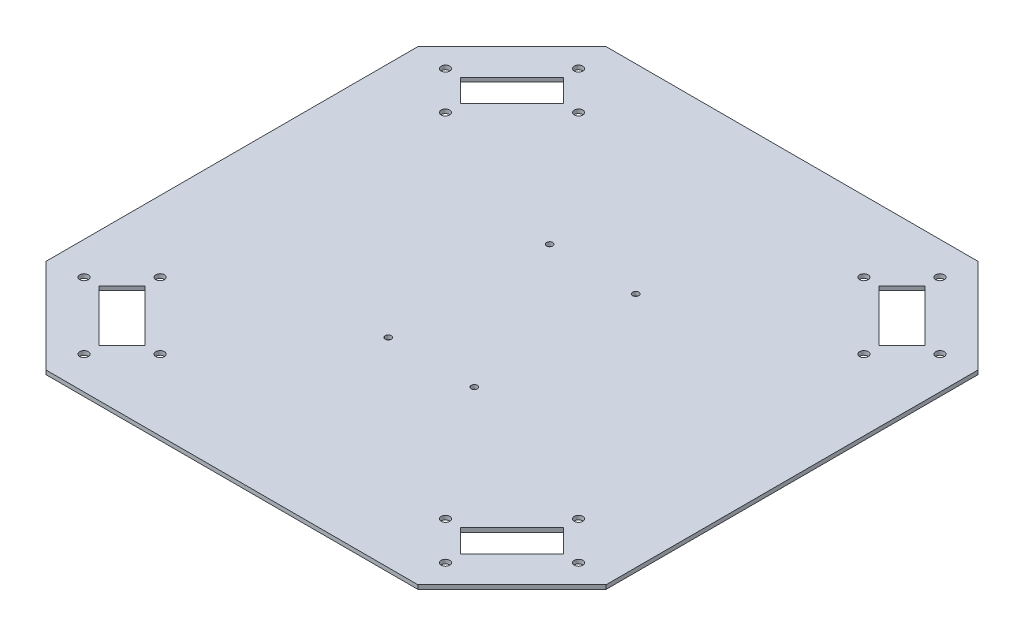
from build123d import *

# Parameters (mm, degrees)
SKETCH2_R           = 1.6
SKETCH2_R_2         = 1.15
BOSS_EXTRUDE1_DEPTH = 1.5


with BuildPart() as part:
    # Sketch2 → Boss-Extrude1 (new body)
    with BuildSketch(Plane(origin=(0, 0, 0), x_dir=(1, 0, 0), z_dir=(0, 1, 0))):
        Polygon((104.138617256, -69.138617256), (104.138617256, 69.138617256), (69.138617256, 104.138617256), (-69.138617256, 104.138617256), (-104.138617256, 69.138617256), (-104.138617256, -69.138617256), (-69.138617256, -104.138617256), (69.138617256, -104.138617256), align=None)
        with Locations(Location((67.193180773, -91.941918115, 0), (0, 0, 270))):
            Circle(SKETCH2_R, mode=Mode.SUBTRACT)
        with Locations(Location((53.051045149, -77.799782491, 0), (0, 0, 270))):
            Circle(SKETCH2_R, mode=Mode.SUBTRACT)
        with Locations(Location((77.799782491, -53.051045149, 0), (0, 0, 270))):
            Circle(SKETCH2_R, mode=Mode.SUBTRACT)
        with Locations(Location((91.941918115, -67.193180773, 0), (0, 0, 270))):
            Circle(SKETCH2_R, mode=Mode.SUBTRACT)
        with Locations(Location((-67.193180773, -91.941918115, 0), (0, 0, 270))):
            Circle(SKETCH2_R, mode=Mode.SUBTRACT)
        with Locations(Location((-91.941918115, -67.193180773, 0), (0, 0, 270))):
            Circle(SKETCH2_R, mode=Mode.SUBTRACT)
        with Locations(Location((-77.799782491, -53.051045149, 0), (0, 0, 270))):
            Circle(SKETCH2_R, mode=Mode.SUBTRACT)
        with Locations(Location((-53.051045149, -77.799782491, 0), (0, 0, 270))):
            Circle(SKETCH2_R, mode=Mode.SUBTRACT)
        with Locations(Location((-77.799782491, 53.051045149, 0), (0, 0, 270))):
            Circle(SKETCH2_R, mode=Mode.SUBTRACT)
        with Locations(Location((-53.051045149, 77.799782491, 0), (0, 0, 270))):
            Circle(SKETCH2_R, mode=Mode.SUBTRACT)
        with Locations(Location((-67.193180773, 91.941918115, 0), (0, 0, 270))):
            Circle(SKETCH2_R, mode=Mode.SUBTRACT)
        with Locations(Location((-91.941918115, 67.193180773, 0), (0, 0, 270))):
            Circle(SKETCH2_R, mode=Mode.SUBTRACT)
        with Locations(Location((77.799782491, 53.051045149, 0), (0, 0, 270))):
            Circle(SKETCH2_R, mode=Mode.SUBTRACT)
        with Locations(Location((53.051045149, 77.799782491, 0), (0, 0, 270))):
            Circle(SKETCH2_R, mode=Mode.SUBTRACT)
        with Locations(Location((67.193180773, 91.941918115, 0), (0, 0, 270))):
            Circle(SKETCH2_R, mode=Mode.SUBTRACT)
        with Locations(Location((91.941918115, 67.193180773, 0), (0, 0, 270))):
            Circle(SKETCH2_R, mode=Mode.SUBTRACT)
        with Locations(Location((16, 30, 0), (0, 0, 270))):
            Circle(SKETCH2_R_2, mode=Mode.SUBTRACT)
        with Locations(Location((-16, 30, 0), (0, 0, 270))):
            Circle(SKETCH2_R_2, mode=Mode.SUBTRACT)
        with Locations(Location((-16, -30, 0), (0, 0, 270))):
            Circle(SKETCH2_R_2, mode=Mode.SUBTRACT)
        with Locations(Location((16, -30, 0), (0, 0, 270))):
            Circle(SKETCH2_R_2, mode=Mode.SUBTRACT)
        Polygon((86.285063865, -67.193180773), (77.799782491, -58.707899399), (58.707899399, -77.799782491), (67.193180773, -86.285063865), align=None, mode=Mode.SUBTRACT)
        Polygon((-67.193180773, -86.285063865), (-58.707899399, -77.799782491), (-77.799782491, -58.707899399), (-86.285063865, -67.193180773), align=None, mode=Mode.SUBTRACT)
        Polygon((-86.285063865, 67.193180773), (-77.799782491, 58.707899399), (-58.707899399, 77.799782491), (-67.193180773, 86.285063865), align=None, mode=Mode.SUBTRACT)
        Polygon((77.799782491, 58.707899399), (86.285063865, 67.193180773), (67.193180773, 86.285063865), (58.707899399, 77.799782491), align=None, mode=Mode.SUBTRACT)
    extrude(amount=BOSS_EXTRUDE1_DEPTH)


solid = part.part
